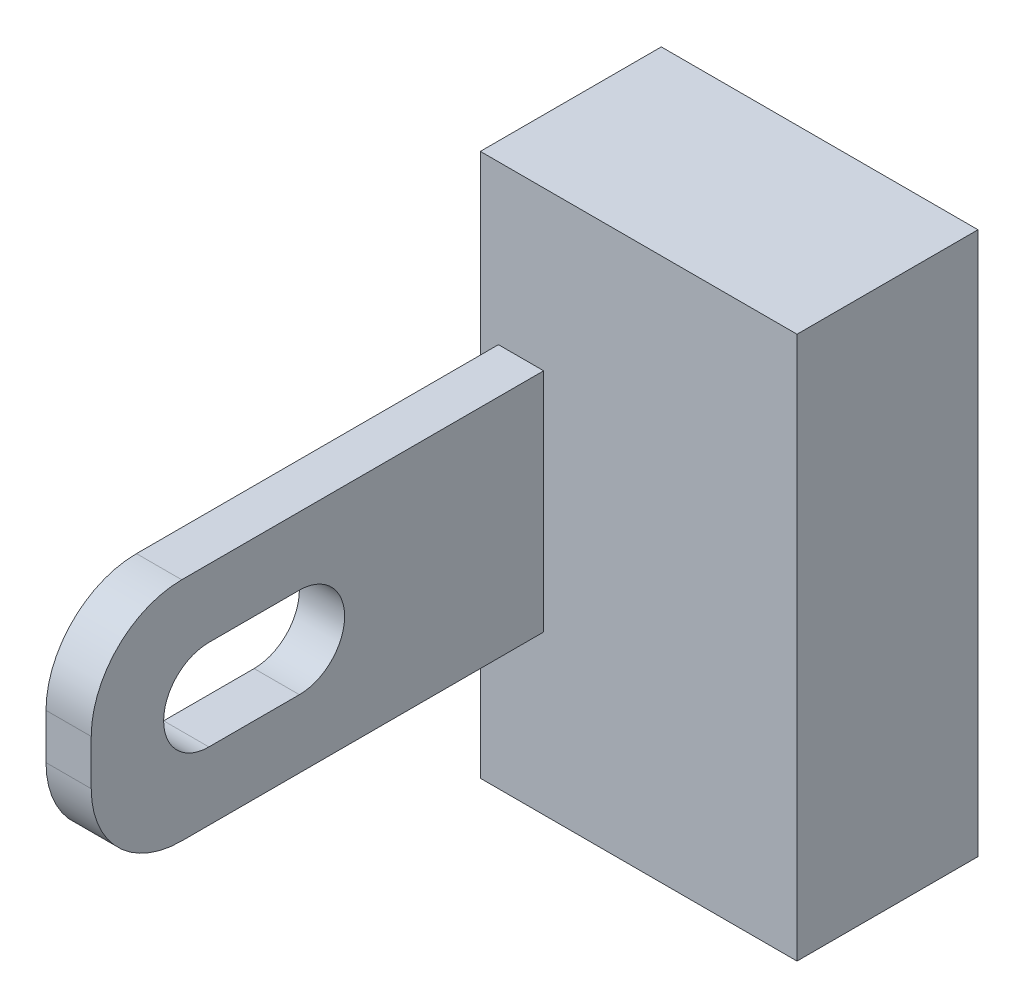
from build123d import *

# Parameters (mm, degrees)
SKETCH1_W           = 3.5
SKETCH1_H           = 6
BOSS_EXTRUDE1_DEPTH = 2
SKETCH2_W           = 0.5
SKETCH2_H           = 2.5
BOSS_EXTRUDE2_DEPTH = 5
FILLET1_R           = 1
CUT_EXTRUDE1_DEPTH  = 9.3


with BuildPart() as part:
    # Sketch1 → Boss-Extrude1 (new body)
    with BuildSketch(Plane.XY):
        Rectangle(SKETCH1_W, SKETCH1_H)
    extrude(amount=BOSS_EXTRUDE1_DEPTH)

    # Sketch2 → Boss-Extrude2 (add)
    with BuildSketch(Plane.XY.offset(2)):
        with Locations((-1.3, 0)):
            Rectangle(SKETCH2_W, SKETCH2_H)
    extrude(amount=BOSS_EXTRUDE2_DEPTH)

    # Fillet1
    fillet1_edges = [part.edges().sort_by_distance(p)[0] for p in [
        (-1.3, 1.25, 7),
        (-1.3, -1.25, 7),
    ]]
    fillet(fillet1_edges, radius=FILLET1_R)

    # Sketch3 → Cut-Extrude1 (cut, through all)
    with BuildSketch(Plane.ZY.offset(1.55)):
        with BuildLine():
            Line((4.7, 0.5), (5.7, 0.5))
            ThreePointArc((5.7, 0.5), (6.2, 0), (5.7, -0.5))
            Line((5.7, -0.5), (4.7, -0.5))
            ThreePointArc((4.7, -0.5), (4.2, 0), (4.7, 0.5))
        make_face()
    extrude(amount=-CUT_EXTRUDE1_DEPTH, mode=Mode.SUBTRACT)


solid = part.part
